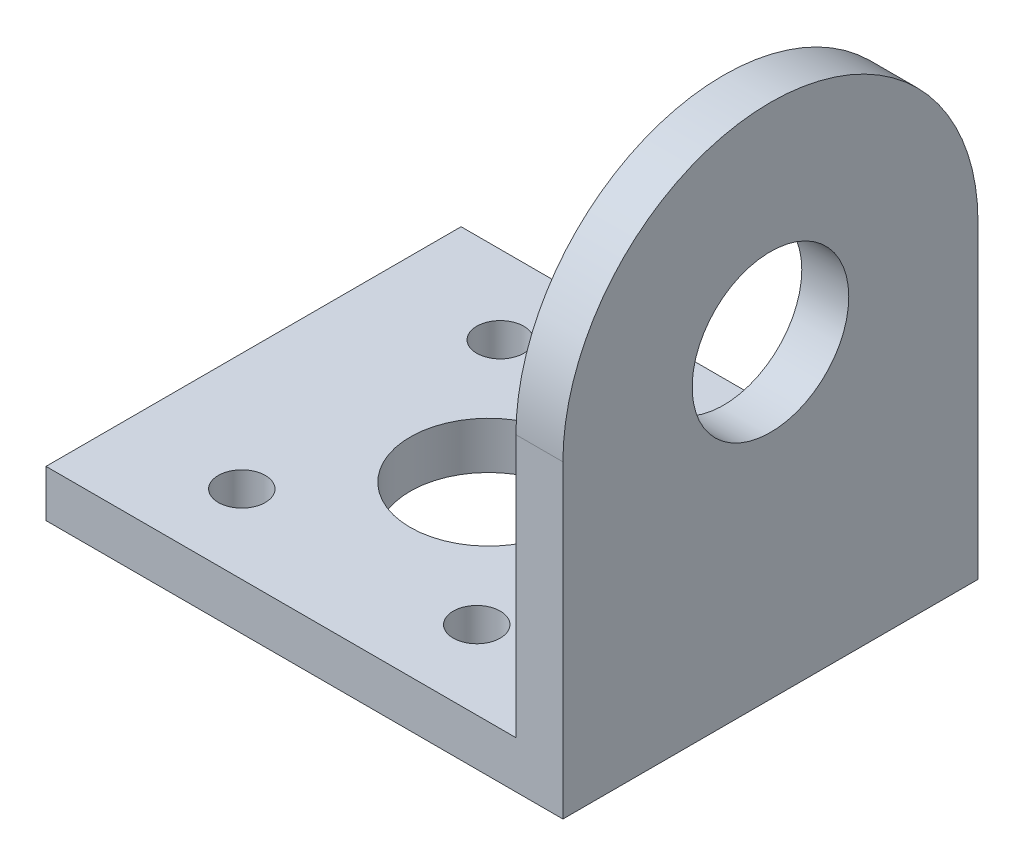
from build123d import *

# Parameters (mm, degrees)
SKETCH1_W           = 30
SKETCH1_H           = 26.5
SKETCH1_R           = 5
SKETCH1_R_2         = 1.5
BOSS_EXTRUDE1_DEPTH = 3
SKETCH2_W           = 3
SKETCH2_H           = 26.5
BOSS_EXTRUDE2_DEPTH = 33
CUT_EXTRUDE1_DEPTH  = 33
SKETCH4_R           = 5
CUT_EXTRUDE2_DEPTH  = 49.513529041


with BuildPart() as part:
    # Sketch1 → Boss-Extrude1 (new body)
    with BuildSketch(Plane(origin=(0, 0, 0), x_dir=(1, 0, 0), z_dir=(0, 1, 0))):
        Rectangle(SKETCH1_W, SKETCH1_H)
        with Locations(Location((0, 0, 0), (0, 0, 270))):
            Circle(SKETCH1_R, mode=Mode.SUBTRACT)
        with Locations(Location((7.5, 8.25, 0), (0, 0, 270))):
            Circle(SKETCH1_R_2, mode=Mode.SUBTRACT)
        with Locations(Location((-7.5, 8.25, 0), (0, 0, 90))):
            Circle(SKETCH1_R_2, mode=Mode.SUBTRACT)
        with Locations(Location((-7.5, -8.25, 0), (0, 0, 270))):
            Circle(SKETCH1_R_2, mode=Mode.SUBTRACT)
        with Locations(Location((7.5, -8.25, 0), (0, 0, 90))):
            Circle(SKETCH1_R_2, mode=Mode.SUBTRACT)
    extrude(amount=BOSS_EXTRUDE1_DEPTH)

    # Sketch2 → Boss-Extrude2 (add)
    with BuildSketch(Plane(origin=(0, 0, 0), x_dir=(1, 0, 0), z_dir=(0, 1, 0))):
        with Locations((16.5, 0)):
            Rectangle(SKETCH2_W, SKETCH2_H)
    extrude(amount=BOSS_EXTRUDE2_DEPTH)

    # Sketch3 → Cut-Extrude1 (cut)
    with BuildSketch(Plane.ZY.offset(-15)):
        with BuildLine():
            Line((0, 33), (-13.25, 33))
            Line((-13.25, 33), (-13.25, 19.75))
            ThreePointArc((-13.25, 19.75), (-9.369164851, 29.119164851), (0, 33))
        make_face()
        with BuildLine():
            Line((13.25, 33), (0, 33))
            ThreePointArc((0, 33), (9.369164851, 29.119164851), (13.25, 19.75))
            Line((13.25, 19.75), (13.25, 33))
        make_face()
    extrude(amount=-CUT_EXTRUDE1_DEPTH, mode=Mode.SUBTRACT)

    # Sketch4 → Cut-Extrude2 (cut, through all)
    with BuildSketch(Plane(origin=(18, 0, 0), x_dir=(0, 0, -1), z_dir=(1, 0, 0))):
        with Locations((0, 19.75)):
            Circle(SKETCH4_R)
    extrude(amount=-CUT_EXTRUDE2_DEPTH, mode=Mode.SUBTRACT)


solid = part.part
